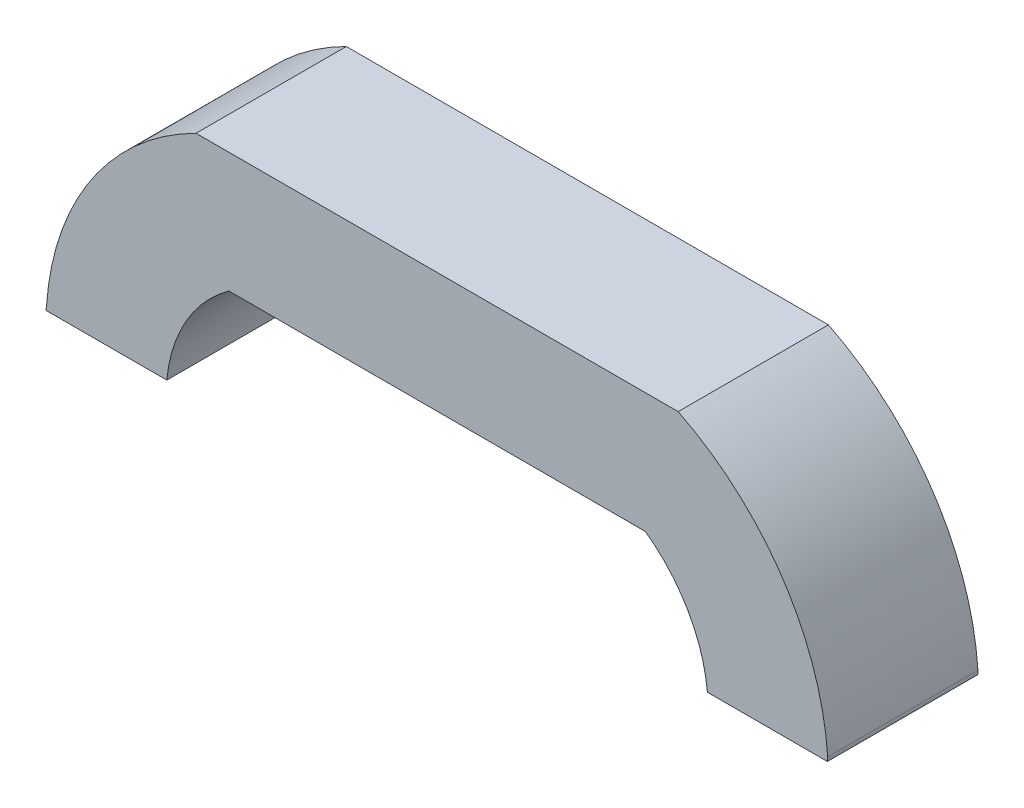
from build123d import *

# Parameters (mm, degrees)
BOSS_EXTRUDE1_DEPTH = 25
SKETCH3_R           = 2
CUT_EXTRUDE1_DEPTH  = 10


with BuildPart() as part:
    # Sketch2 → Boss-Extrude1 (new body)
    with BuildSketch(Plane.XY):
        with BuildLine():
            Line((-34.654096647, 18), (33.564112537, 18))
            Line((33.564112537, 18), (34.654096647, 18))
            ThreePointArc((34.654096647, 18), (41.754772696, 10.113790987), (44.967734696, 0))
            Line((44.967734696, 0), (64.929939713, 0))
            ThreePointArc((64.929939713, 0), (64.983093484, 0.336809111), (64.97700751, 0.677732359))
            ThreePointArc((64.97700751, 0.677732359), (57.505542276, 22.646902561), (40.105840234, 38))
            Line((40.105840234, 38), (33.564112537, 38))
            Line((33.564112537, 38), (-40.105840234, 38))
            ThreePointArc((-40.105840234, 38), (-57.505542276, 22.646902561), (-64.97700751, 0.677732359))
            ThreePointArc((-64.97700751, 0.677732359), (-65.02406211, 0.339344907), (-65.063625193, 0))
            Line((-65.063625193, 0), (-44.967734696, 0))
            ThreePointArc((-44.967734696, 0), (-41.754772696, 10.113790987), (-34.654096647, 18))
        make_face()
    extrude(amount=BOSS_EXTRUDE1_DEPTH)

    # Sketch3 → Cut-Extrude1 (cut)
    with BuildSketch(Plane.XZ):
        with Locations(Location((-55, 12.5, 0), (0, 0, 270))):
            Circle(SKETCH3_R)
        with Locations(Location((55, 12.5, 0), (0, 0, 90))):
            Circle(SKETCH3_R)
    extrude(amount=-CUT_EXTRUDE1_DEPTH, mode=Mode.SUBTRACT)


solid = part.part
